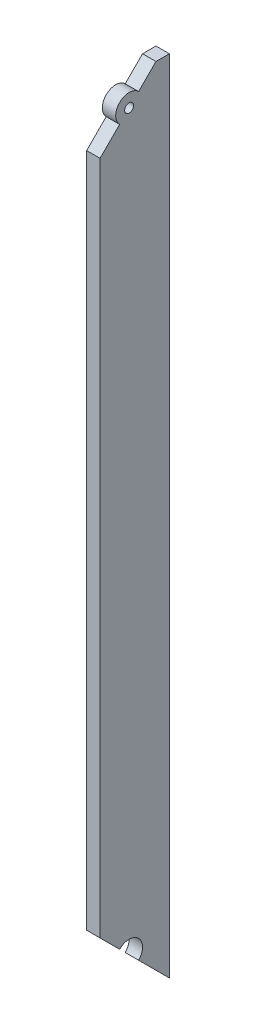
from build123d import *

# Parameters (mm, degrees)
BOSS_EXTRUDE1_DEPTH = 6
SKETCH4_R           = 6
BOSS_EXTRUDE2_DEPTH = 6
SKETCH3_R           = 2
SKETCH3_R_2         = 6
CUT_EXTRUDE1_DEPTH  = 353.937671551


with BuildPart() as part:
    # Sketch2 → Boss-Extrude1 (new body)
    with BuildSketch(Plane(origin=(0, 0, 0), x_dir=(0, 0, -1), z_dir=(1, 0, 0))):
        Polygon((6, 352), (0, 352), (-25, 327), (-25, 25), (6, -6), align=None)
    extrude(amount=BOSS_EXTRUDE1_DEPTH)

    # Sketch4 → Boss-Extrude2 (add)
    with BuildSketch(Plane(origin=(6, 0, 0), x_dir=(0, 0, -1), z_dir=(1, 0, 0))):
        with Locations((-12, 340)):
            Circle(SKETCH4_R)
    extrude(amount=-BOSS_EXTRUDE2_DEPTH)

    # Sketch3 → Cut-Extrude1 (cut, through all)
    with BuildSketch(Plane(origin=(6, 0, 0), x_dir=(0, 0, -1), z_dir=(1, 0, 0))):
        with Locations((-12, 340)):
            Circle(SKETCH3_R)
        with Locations((-12, 12)):
            Circle(SKETCH3_R_2)
    extrude(amount=-CUT_EXTRUDE1_DEPTH, mode=Mode.SUBTRACT)


solid = part.part
